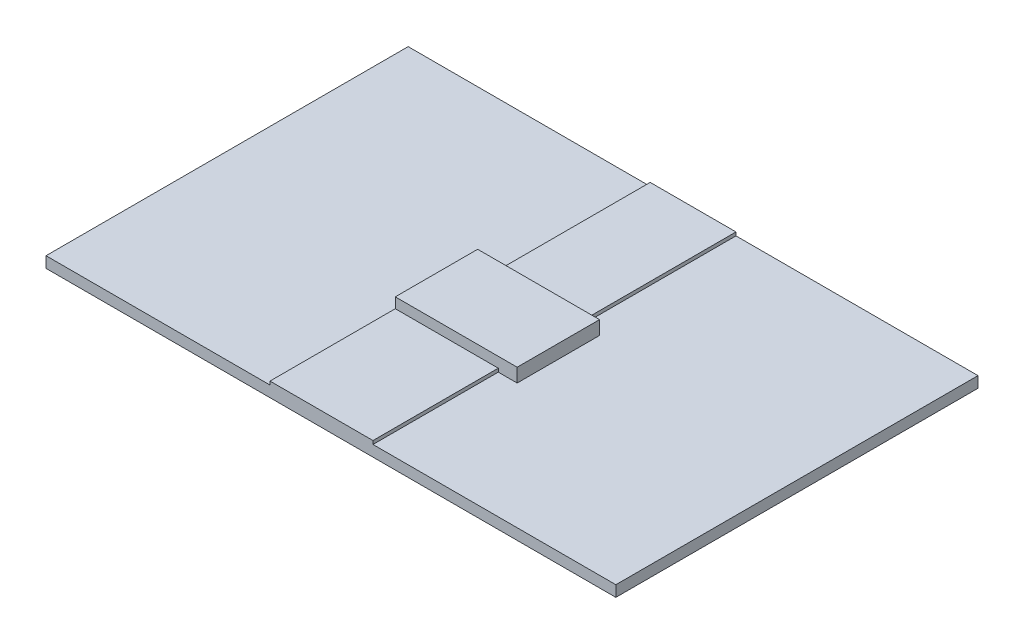
from build123d import *

# Parameters (mm, degrees)
BOSS_EXTRUDE1_DEPTH = 4
SKETCH1_3_W         = 166
SKETCH1_3_H         = 105.5
BOSS_EXTRUDE2_DEPTH = 3.2
SKETCH1_4_W         = 25
SKETCH1_4_H         = 45
SKETCH1_4_W_2       = 30
SKETCH1_4_H_2       = 36.5
BOSS_EXTRUDE3_DEPTH = 1


with BuildPart() as part:
    # Sketch1 → Boss-Extrude1 (new body)
    with BuildSketch(Plane(origin=(0, 0, 0), x_dir=(1, 0, 0), z_dir=(0, 1, 0))):
        Polygon((12.5, 7.75), (-12.5, 7.75), (-17.75, 7.75), (-17.75, -16.25), (12.25, -16.25), (17.75, -16.25), (17.75, 7.75), align=None)
    extrude(amount=BOSS_EXTRUDE1_DEPTH)

    # Sketch1<3> → Boss-Extrude2 (add)
    with BuildSketch(Plane(origin=(0, 0, 0), x_dir=(1, 0, 0), z_dir=(0, 1, 0))):
        Rectangle(SKETCH1_3_W, SKETCH1_3_H)
    extrude(amount=-BOSS_EXTRUDE2_DEPTH)

    # Sketch1<4> → Boss-Extrude3 (add)
    with BuildSketch(Plane(origin=(0, 0, 0), x_dir=(1, 0, 0), z_dir=(0, 1, 0))):
        with Locations((0, 30.25)):
            Rectangle(SKETCH1_4_W, SKETCH1_4_H)
        with Locations((-2.75, -34.5)):
            Rectangle(SKETCH1_4_W_2, SKETCH1_4_H_2)
    extrude(amount=BOSS_EXTRUDE3_DEPTH)


solid = part.part
